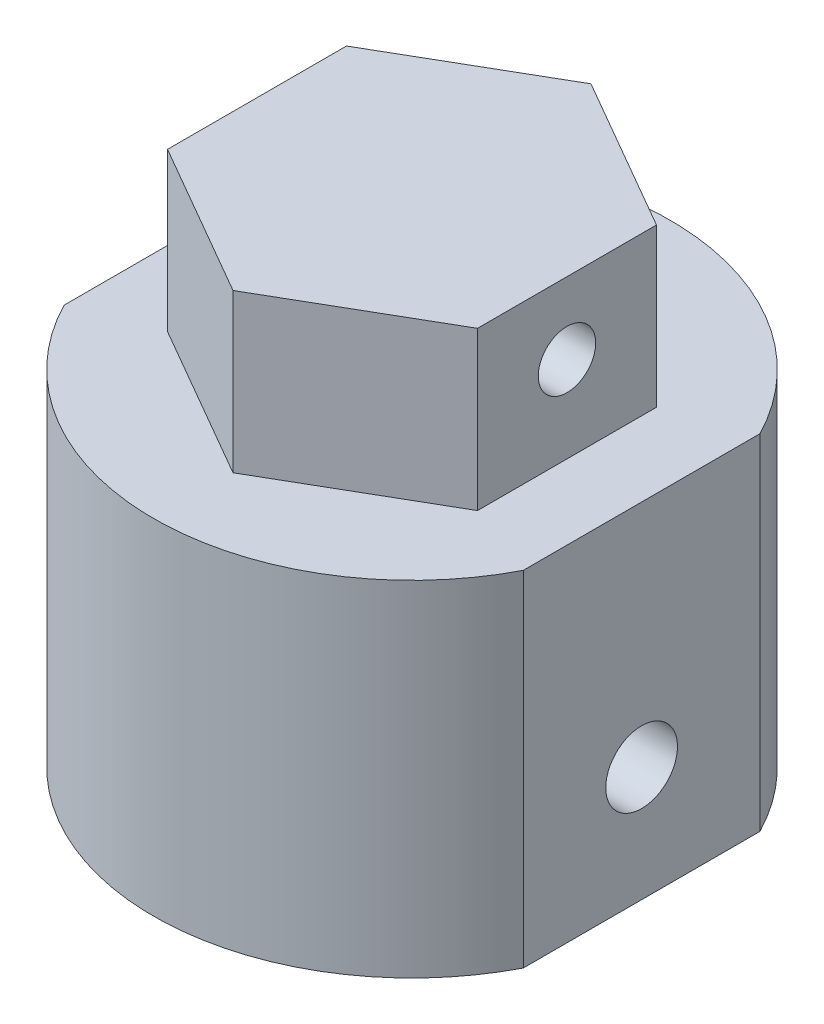
from build123d import *

# Parameters (mm, degrees)
ESBO_O1_R                = 9
RESSALTO_EXTRUS_O1_DEPTH = 12
RESSALTO_EXTRUS_O2_DEPTH = 5.5
ESBO_O3_R                = 1
CORTE_EXTRUS_O1_DEPTH    = 25.384626304
ESBO_O4_R                = 3.125
CORTE_EXTRUS_O2_DEPTH    = 12
CORTE_EXTRUS_O3_REACH    = 23.639
ESBO_O6_R                = 1.25
CORTE_EXTRUS_O4_DEPTH    = 26.362373706


with BuildPart() as part:
    # Esboço1 → Ressalto-extrusão1 (new body)
    with BuildSketch(Plane(origin=(0, 0, 0), x_dir=(1, 0, 0), z_dir=(0, 1, 0))):
        with Locations(Location((0, 0, 0), (0, 0, 270))):
            Circle(ESBO_O1_R)
    extrude(amount=RESSALTO_EXTRUS_O1_DEPTH)

    # Esboço2 → Ressalto-extrusão2 (add)
    with BuildSketch(Plane(origin=(0, 12, 0), x_dir=(1, 0, 0), z_dir=(0, 1, 0))):
        Polygon((0, 6.235382907), (-5.4, 3.117691454), (-5.4, -3.117691454), (0, -6.235382907), (5.4, -3.117691454), (5.4, 3.117691454), align=None)
    extrude(amount=RESSALTO_EXTRUS_O2_DEPTH)

    # Esboço3 → Corte-extrusão1 (cut, through all)
    with BuildSketch(Plane.ZY.offset(5.4)):
        with Locations((0, 15)):
            Circle(ESBO_O3_R)
    extrude(amount=-CORTE_EXTRUS_O1_DEPTH, mode=Mode.SUBTRACT)

    # Esboço4 → Corte-extrusão2 (cut)
    with BuildSketch(Plane.XZ):
        with Locations(Location((0, 0, 0), (0, 0, 270))):
            Circle(ESBO_O4_R)
    extrude(amount=-CORTE_EXTRUS_O2_DEPTH, mode=Mode.SUBTRACT)

    # Esboço5 → Corte-extrusão3 (cut, up to next)
    with BuildSketch(Plane.XZ, mode=Mode.PRIVATE) as corte_extrus_o3_sk1:
        with BuildLine():
            Line((-8, -4.123105626), (-8, 4.123105626))
            ThreePointArc((-8, 4.123105626), (-9, 0), (-8, -4.123105626))
        make_face()
    corte_extrus_o3_tool1 = extrude(corte_extrus_o3_sk1.sketch, amount=-CORTE_EXTRUS_O3_REACH, mode=Mode.PRIVATE) & part.part
    # Esboço5 → Corte-extrusão3 (cut, up to next)
    with BuildSketch(Plane.XZ, mode=Mode.PRIVATE) as corte_extrus_o3_sk2:
        with BuildLine():
            Line((8, -4.123105626), (8, 4.123105626))
            ThreePointArc((8, 4.123105626), (9, 0), (8, -4.123105626))
        make_face()
    corte_extrus_o3_tool2 = extrude(corte_extrus_o3_sk2.sketch, amount=-CORTE_EXTRUS_O3_REACH, mode=Mode.PRIVATE) & part.part
    add(corte_extrus_o3_tool1.solids().sort_by_distance((-8.401968, 0, 0))[0], mode=Mode.SUBTRACT)
    add(corte_extrus_o3_tool2.solids().sort_by_distance((8.401968, 0, 0))[0], mode=Mode.SUBTRACT)

    # Esboço6 → Corte-extrusão4 (cut, through all)
    with BuildSketch(Plane.ZY.offset(8)):
        with Locations((0, 4)):
            Circle(ESBO_O6_R)
    extrude(amount=-CORTE_EXTRUS_O4_DEPTH, mode=Mode.SUBTRACT)


solid = part.part
